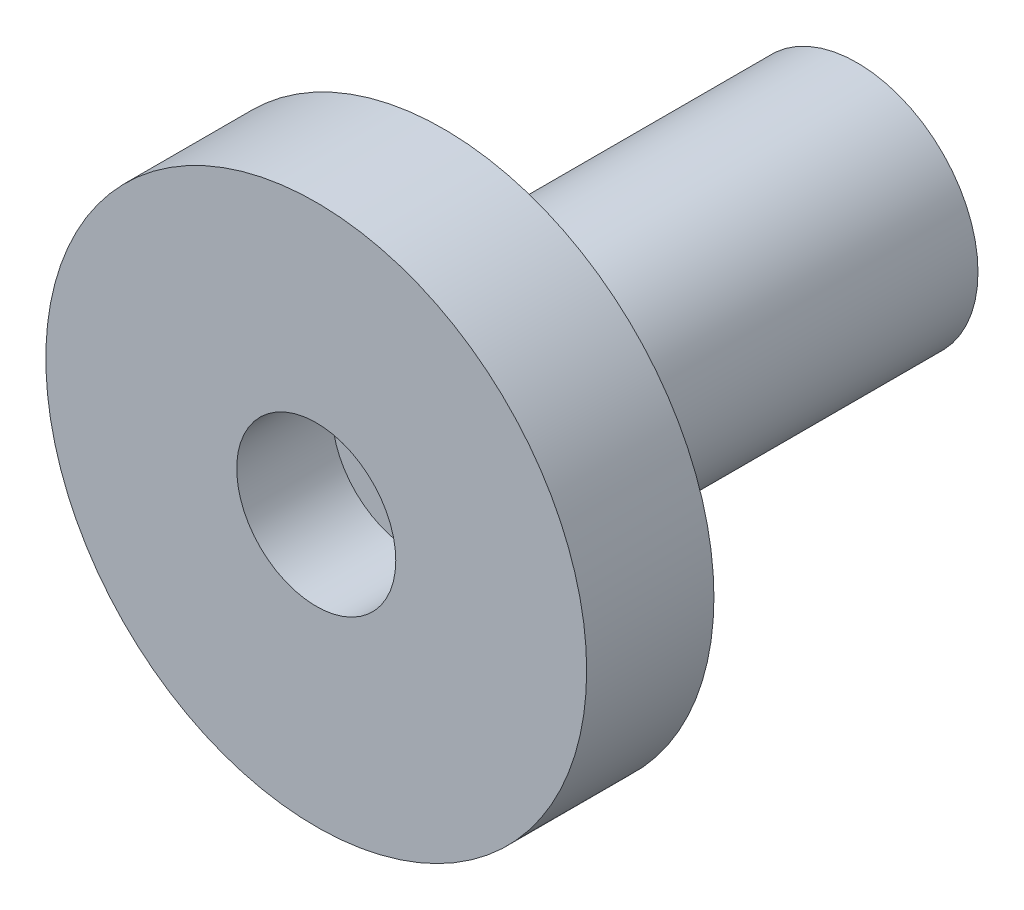
from build123d import *

# Parameters (mm, degrees)
BOSS_EXTRUDE1_DEPTH      = 5
BOSS_EXTRUDE1_DEPTH_BACK = 8
SKETCH1_R                = 3.8
SKETCH1_R_2              = 1.6
SKETCH2_R                = 8.5
BOSS_EXTRUDE2_DEPTH      = 4
SKETCH4_R                = 1.6
CUT_EXTRUDE1_DEPTH       = 4
SKETCH5_R                = 2.5
CUT_EXTRUDE2_DEPTH       = 3


with BuildPart() as part:
    # Sketch1 → Boss-Extrude1 (new, two sides: drawn at the far end of the back side and taken through both)
    with BuildSketch(Plane.XY.offset(-BOSS_EXTRUDE1_DEPTH_BACK)):
        with Locations((-58.8, 0)):
            Circle(SKETCH1_R)
        with Locations((-58.8, 0)):
            Circle(SKETCH1_R_2, mode=Mode.SUBTRACT)
    extrude(amount=BOSS_EXTRUDE1_DEPTH + BOSS_EXTRUDE1_DEPTH_BACK)

    # Sketch2 → Boss-Extrude2 (add)
    with BuildSketch(Plane.XY.offset(5)):
        with Locations((-58.8, 0)):
            Circle(SKETCH2_R)
    extrude(amount=BOSS_EXTRUDE2_DEPTH)

    # Sketch4 → Cut-Extrude1 (cut)
    with BuildSketch(Plane(origin=(0, 0, 5), x_dir=(-1, 0, 0), z_dir=(0, 0, -1))):
        with Locations(Location((58.8, 0, 0), (0, 0, 180))):
            Circle(SKETCH4_R)
    extrude(amount=-CUT_EXTRUDE1_DEPTH, mode=Mode.SUBTRACT)

    # Sketch5 → Cut-Extrude2 (cut)
    with BuildSketch(Plane.XY.offset(9)):
        with Locations((-58.8, 0)):
            Circle(SKETCH5_R)
    extrude(amount=-CUT_EXTRUDE2_DEPTH, mode=Mode.SUBTRACT)


solid = part.part
